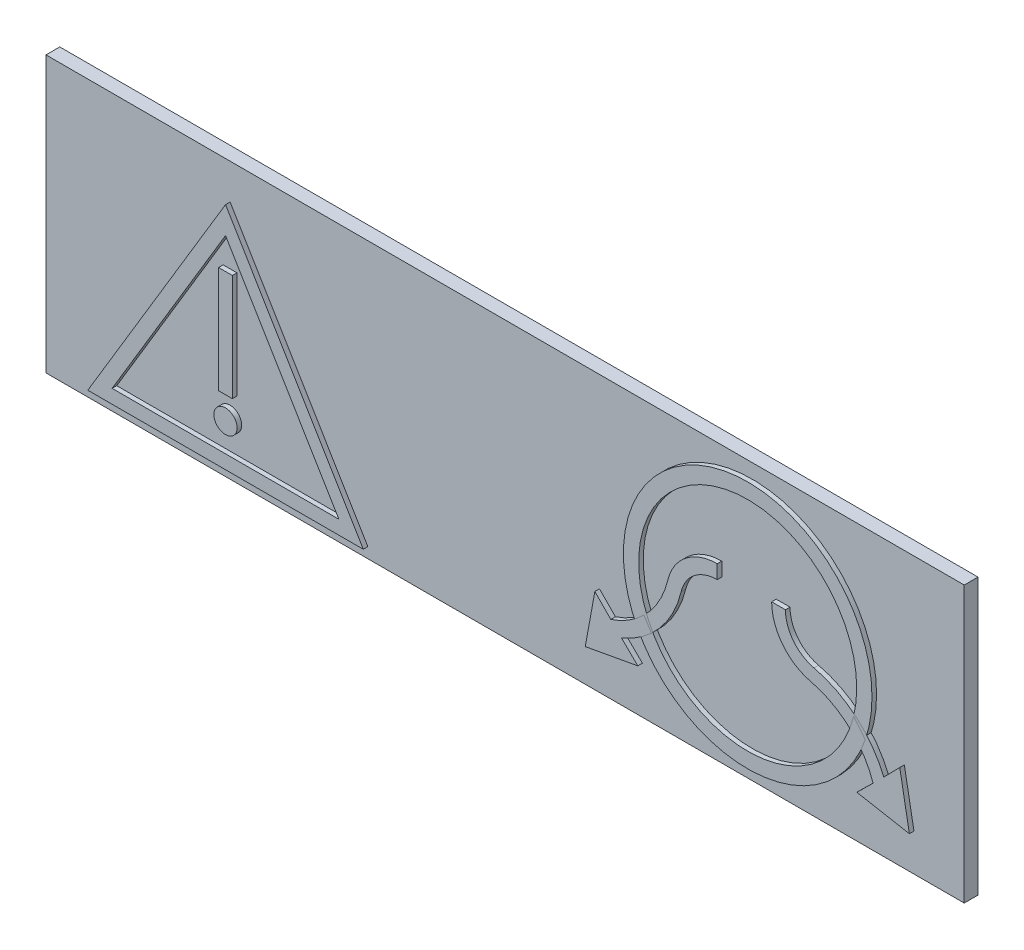
from build123d import *

# Parameters (mm, degrees)
ESQUISSE1_W        = 20
ESQUISSE1_H        = 6
EXTRUSION1_DEPTH   = 0.3
EXTRUSION2_DEPTH   = 0.1
ESQUISSE4_R        = 0.252442903
EXTRUSION3_DEPTH   = 0.1
ESQUISSE4_W        = 0.3
ESQUISSE4_H        = 2.324561381
EXTRUSION3_2_DEPTH = 0.1
ESQUISSE5_R        = 2.7075
ESQUISSE5_R_2      = 2.375
EXTRUSION4_DEPTH   = 0.1
EXTRUSION5_DEPTH   = 0.1
EXTRUSION5_2_DEPTH = 0.1


with BuildPart() as part:
    # Esquisse1 → Extrusion1 (new body)
    with BuildSketch(Plane.XY):
        with Locations((-18.459714286, -39.411857143)):
            Rectangle(ESQUISSE1_W, ESQUISSE1_H)
    extrude(amount=-EXTRUSION1_DEPTH)


with BuildPart() as body_2:
    # Esquisse2 → Extrusion2 (new body)
    with BuildSketch(Plane.XY.offset(0.1)):
        Polygon((-27.34919593, -42.082334703), (-21.34919593, -42.082334703), (-24.34919593, -37.082334703), align=None)
        Polygon((-26.819338817, -41.782334703), (-24.34919593, -37.665429892), (-21.879053044, -41.782334703), align=None, mode=Mode.SUBTRACT)
    extrude(amount=EXTRUSION2_DEPTH)


with BuildPart() as body_3:
    # Esquisse4 → Extrusion3 (new body)
    with BuildSketch(Plane(origin=(-58.09753781, -20.9340219, 0.1), x_dir=(1, 0, 0), z_dir=(0, 0, 1))):
        with Locations((33.747043239, -20.233333315)):
            Circle(ESQUISSE4_R)
    extrude(amount=EXTRUSION3_DEPTH)


with BuildPart() as body_4:
    # Esquisse4 → Extrusion3 2 (new body)
    with BuildSketch(Plane(origin=(-58.09753781, -20.9340219, 0.1), x_dir=(1, 0, 0), z_dir=(0, 0, 1))):
        with Locations((33.747043239, -18.571684889)):
            Rectangle(ESQUISSE4_W, ESQUISSE4_H)
    extrude(amount=EXTRUSION3_2_DEPTH)


with BuildPart() as body_5:
    # Esquisse5 → Extrusion4 (new body)
    with BuildSketch(Plane.XY.offset(0.1)):
        with Locations((-12.976239495, -39.330980348)):
            Circle(ESQUISSE5_R)
        with Locations((-12.976239495, -39.330980348)):
            Circle(ESQUISSE5_R_2, mode=Mode.SUBTRACT)
    extrude(amount=EXTRUSION4_DEPTH)


with BuildPart() as body_6:
    # Esquisse6 → Extrusion5 (new body)
    with BuildSketch(Plane.XY.offset(0.1)):
        with BuildLine():
            Line((-10.24489494, -40.943362369), (-10.599117065, -41.291516686))
            Line((-10.599117065, -41.291516686), (-9.454486879, -41.500809256))
            Line((-9.454486879, -41.500809256), (-9.66377945, -40.356179071))
            Line((-9.66377945, -40.356179071), (-10.011933766, -40.710401195))
            ThreePointArc((-10.011933766, -40.710401195), (-10.616239233, -39.878027502), (-11.533384635, -39.412328702))
            ThreePointArc((-11.533384635, -39.412328702), (-11.980400501, -39.127246423), (-12.154388885, -38.626423967))
            Line((-12.154388885, -38.626423967), (-12.454388885, -38.626423967))
            ThreePointArc((-12.454388885, -38.626423967), (-12.215784735, -39.313241752), (-11.60275622, -39.704197822))
            ThreePointArc((-11.60275622, -39.704197822), (-10.763515026, -40.148113761), (-10.24489494, -40.943362369))
        make_face()
    extrude(amount=EXTRUSION5_DEPTH)


with BuildPart() as body_7:
    # Esquisse6 → Extrusion5 2 (new body)
    with BuildSketch(Plane.XY.offset(0.1)):
        with BuildLine():
            Line((-15.956829451, -40.710401195), (-16.304983767, -40.356179071))
            Line((-16.304983767, -40.356179071), (-16.514276338, -41.500809256))
            Line((-16.514276338, -41.500809256), (-15.369646152, -41.291516686))
            Line((-15.369646152, -41.291516686), (-15.723868277, -40.943362369))
            ThreePointArc((-15.723868277, -40.943362369), (-14.891494584, -40.339056902), (-14.425795784, -39.4219115))
            ThreePointArc((-14.425795784, -39.4219115), (-14.140713505, -38.974895634), (-13.639891048, -38.800907251))
            Line((-13.639891048, -38.800907251), (-13.639891048, -38.500907251))
            ThreePointArc((-13.639891048, -38.500907251), (-14.326708834, -38.7395114), (-14.717664904, -39.352539915))
            ThreePointArc((-14.717664904, -39.352539915), (-15.161580843, -40.191781109), (-15.956829451, -40.710401195))
        make_face()
    extrude(amount=EXTRUSION5_2_DEPTH)


solid = Compound([part.part, body_2.part, body_3.part, body_4.part, body_5.part, body_6.part, body_7.part])
